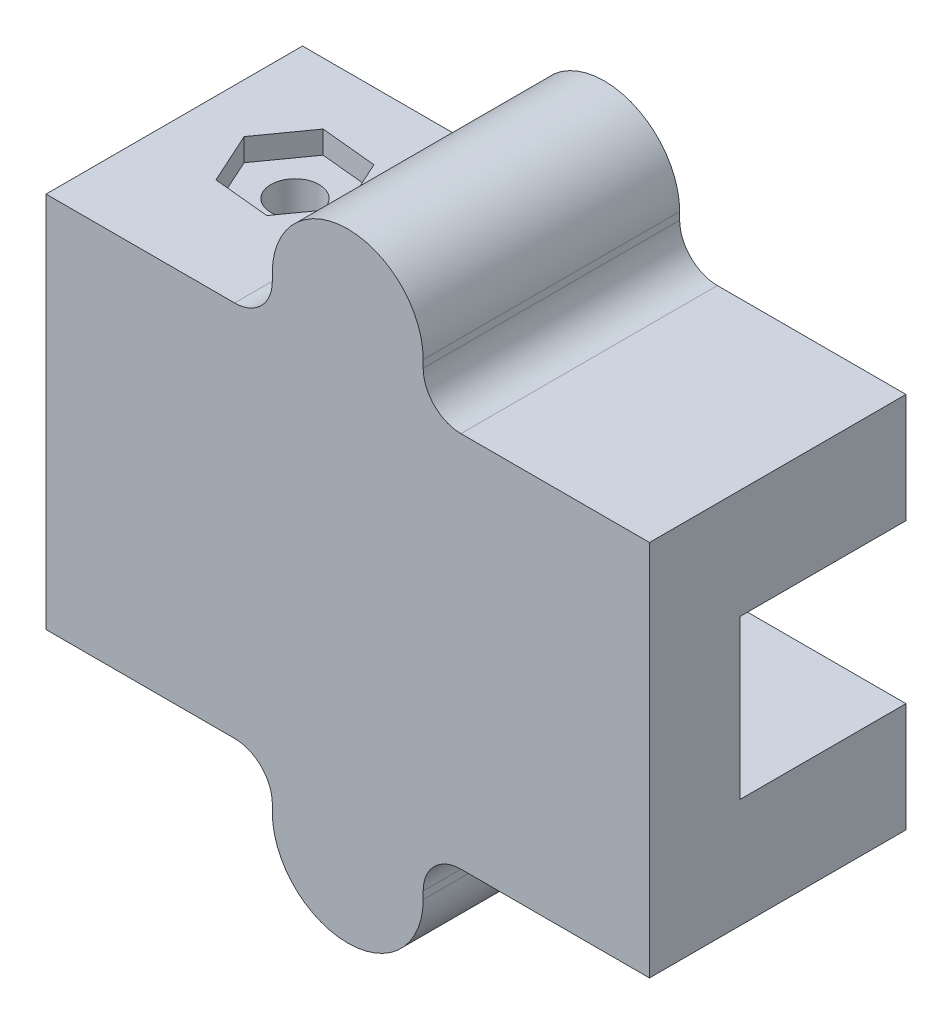
from build123d import *

# Parameters (mm, degrees)
SKETCH1_R           = 2.4
BOSS_EXTRUDE1_DEPTH = 11
BOSS_EXTRUDE2_START = 11
SKETCH1_3_R         = 2.4
SKETCH1_3_W         = 40
SKETCH1_3_H         = 10.5
BOSS_EXTRUDE2_DEPTH = 6
SKETCH3_R           = 4.25
CUT_EXTRUDE1_DEPTH  = 5
SKETCH4_R           = 1.6
CUT_EXTRUDE2_DEPTH  = 43.166337285
CUT_EXTRUDE3_DEPTH  = 1.5
CUT_EXTRUDE5_DEPTH  = 5.2
SKETCH9_R           = 2.4
CUT_EXTRUDE6_DEPTH  = 6


with BuildPart() as part:
    # Sketch1 → Boss-Extrude1 (new body)
    # profile 1 of 4: a face of its own
    with BuildSketch(Plane.XY):
        with BuildLine():
            Line((-7.5, 12.5), (-20, 12.5))
            Line((-20, 12.5), (-20, 5.25))
            Line((-20, 5.25), (20, 5.25))
            Line((20, 5.25), (20, 12.5))
            Line((20, 12.5), (7.5, 12.5))
            ThreePointArc((7.5, 12.5), (5.732233047, 13.232233047), (5, 15))
            Line((5, 15), (5, 15.5))
            ThreePointArc((5, 15.5), (0, 20.5), (-5, 15.5))
            Line((-5, 15.5), (-5, 15))
            ThreePointArc((-5, 15), (-5.732233047, 13.232233047), (-7.5, 12.5))
        make_face()
        with Locations((0, 15.5)):
            Circle(SKETCH1_R, mode=Mode.SUBTRACT)
    # profile 2 of 4: a face of its own
    with BuildSketch(Plane.XY):
        with BuildLine():
            Line((20, -5.25), (-20, -5.25))
            Line((-20, -5.25), (-20, -12.5))
            Line((-20, -12.5), (-7.5, -12.5))
            ThreePointArc((-7.5, -12.5), (-5.732233047, -13.232233047), (-5, -15))
            Line((-5, -15), (-5, -15.5))
            ThreePointArc((-5, -15.5), (0, -20.5), (5, -15.5))
            Line((5, -15.5), (5, -15))
            ThreePointArc((5, -15), (5.732233047, -13.232233047), (7.5, -12.5))
            Line((7.5, -12.5), (20, -12.5))
            Line((20, -12.5), (20, -5.25))
        make_face()
        with Locations((0, -15.5)):
            Circle(SKETCH1_R, mode=Mode.SUBTRACT)
    # profile 3 of 4: a face of its own
    with BuildSketch(Plane.XY):
        with Locations((0, -15.5)):
            Circle(SKETCH1_R)
    # profile 4 of 4: a face of its own
    with BuildSketch(Plane.XY):
        with Locations((0, 15.5)):
            Circle(SKETCH1_R)
    extrude(amount=BOSS_EXTRUDE1_DEPTH)

    # Sketch1<3> → Boss-Extrude2 (add)
    # profile 1 of 5: a face of its own
    with BuildSketch(Plane.XY.offset(BOSS_EXTRUDE2_START)):
        with BuildLine():
            Line((-7.5, 12.5), (-20, 12.5))
            Line((-20, 12.5), (-20, 5.25))
            Line((-20, 5.25), (20, 5.25))
            Line((20, 5.25), (20, 12.5))
            Line((20, 12.5), (7.5, 12.5))
            ThreePointArc((7.5, 12.5), (5.732233047, 13.232233047), (5, 15))
            Line((5, 15), (5, 15.5))
            ThreePointArc((5, 15.5), (0, 20.5), (-5, 15.5))
            Line((-5, 15.5), (-5, 15))
            ThreePointArc((-5, 15), (-5.732233047, 13.232233047), (-7.5, 12.5))
        make_face()
        with Locations((0, 15.5)):
            Circle(SKETCH1_3_R, mode=Mode.SUBTRACT)
    # profile 2 of 5: a face of its own
    with BuildSketch(Plane.XY.offset(BOSS_EXTRUDE2_START)):
        with BuildLine():
            Line((20, -5.25), (-20, -5.25))
            Line((-20, -5.25), (-20, -12.5))
            Line((-20, -12.5), (-7.5, -12.5))
            ThreePointArc((-7.5, -12.5), (-5.732233047, -13.232233047), (-5, -15))
            Line((-5, -15), (-5, -15.5))
            ThreePointArc((-5, -15.5), (0, -20.5), (5, -15.5))
            Line((5, -15.5), (5, -15))
            ThreePointArc((5, -15), (5.732233047, -13.232233047), (7.5, -12.5))
            Line((7.5, -12.5), (20, -12.5))
            Line((20, -12.5), (20, -5.25))
        make_face()
        with Locations((0, -15.5)):
            Circle(SKETCH1_3_R, mode=Mode.SUBTRACT)
    # profile 3 of 5: a face of its own
    with BuildSketch(Plane.XY.offset(BOSS_EXTRUDE2_START)):
        with Locations((0, -15.5)):
            Circle(SKETCH1_3_R)
    # profile 4 of 5: a face of its own
    with BuildSketch(Plane.XY.offset(BOSS_EXTRUDE2_START)):
        with Locations((0, 15.5)):
            Circle(SKETCH1_3_R)
    # profile 5 of 5: a face of its own
    with BuildSketch(Plane.XY.offset(BOSS_EXTRUDE2_START)):
        Rectangle(SKETCH1_3_W, SKETCH1_3_H)
    extrude(amount=BOSS_EXTRUDE2_DEPTH)

    # Sketch3 → Cut-Extrude1 (cut)
    with BuildSketch(Plane(origin=(0, 0, 11), x_dir=(-1, 0, 0), z_dir=(0, 0, -1))):
        with Locations((-14, 0)):
            Circle(SKETCH3_R)
    extrude(amount=-CUT_EXTRUDE1_DEPTH, mode=Mode.SUBTRACT)

    # Sketch4 → Cut-Extrude2 (cut, through all)
    with BuildSketch(Plane.XZ.offset(12.5)):
        with Locations(Location((-13, 7.5, 0), (0, 0, 270))):
            Circle(SKETCH4_R)
    extrude(amount=-CUT_EXTRUDE2_DEPTH, mode=Mode.SUBTRACT)

    # Sketch5 → Cut-Extrude3 (cut)
    with BuildSketch(Plane(origin=(0, 12.5, 0), x_dir=(1, 0, 0), z_dir=(0, 1, 0))):
        Polygon((-9.264912438, -7.863942626), (-10.817272659, -4.447290599), (-14.552360221, -4.083347973), (-16.735087562, -7.136057374), (-15.182727341, -10.552709401), (-11.447639779, -10.916652027), align=None)
    extrude(amount=-CUT_EXTRUDE3_DEPTH, mode=Mode.SUBTRACT)

    # Sketch7 → Cut-Extrude5 (cut)
    with BuildSketch(Plane(origin=(0, 0, 0), x_dir=(-1, 0, 0), z_dir=(0, 0, -1))):
        with BuildLine():
            Line((-5, 11.475), (5, 11.475))
            ThreePointArc((5, 11.475), (7.6, 8.875), (5, 6.275))
            Line((5, 6.275), (-5, 6.275))
            ThreePointArc((-5, 6.275), (-7.6, 8.875), (-5, 11.475))
        make_face()
        with BuildLine():
            Line((-5, -11.475), (5, -11.475))
            ThreePointArc((5, -11.475), (7.6, -8.875), (5, -6.275))
            Line((5, -6.275), (-5, -6.275))
            ThreePointArc((-5, -6.275), (-7.6, -8.875), (-5, -11.475))
        make_face()
    extrude(amount=-CUT_EXTRUDE5_DEPTH, mode=Mode.SUBTRACT)

    # Sketch9 → Cut-Extrude6 (cut)
    with BuildSketch(Plane(origin=(0, 0, 0), x_dir=(-1, 0, 0), z_dir=(0, 0, -1))):
        with Locations((0, -15.5)):
            Circle(SKETCH9_R)
        with Locations(Location((0, 15.5, 0), (0, 0, 180))):
            Circle(SKETCH9_R)
    extrude(amount=-CUT_EXTRUDE6_DEPTH, mode=Mode.SUBTRACT)


solid = part.part
